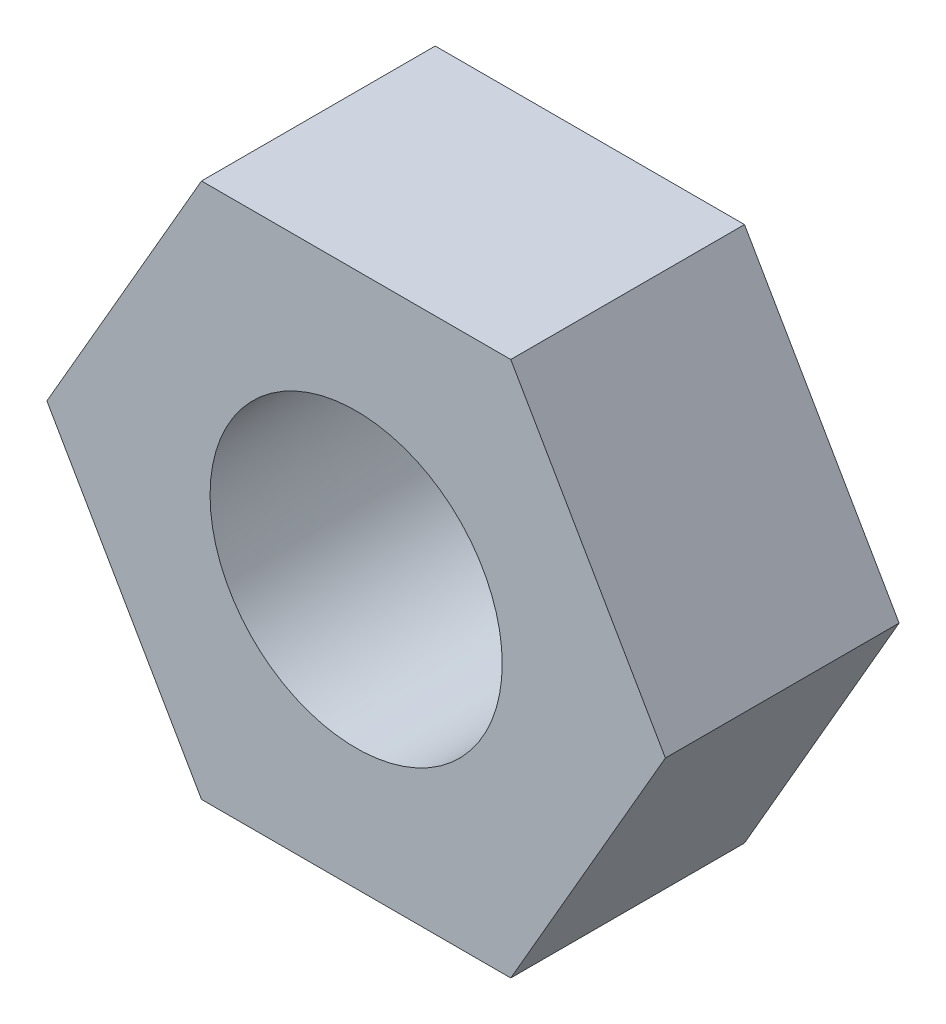
from build123d import *

# Parameters (mm, degrees)
SKETCH1_R                       = 1.5
NUT_THREAD_MAJOR_ENVELOPE_DEPTH = 2.4


with BuildPart() as part:
    # Sketch1 → Nut_Thread_Major_Envelope (new body)
    with BuildSketch(Plane.XY):
        Polygon((3.175426481, 0), (1.58771324, 2.75), (-1.58771324, 2.75), (-3.175426481, 0), (-1.58771324, -2.75), (1.58771324, -2.75), align=None)
        Circle(SKETCH1_R, mode=Mode.SUBTRACT)
    extrude(amount=NUT_THREAD_MAJOR_ENVELOPE_DEPTH)


solid = part.part
